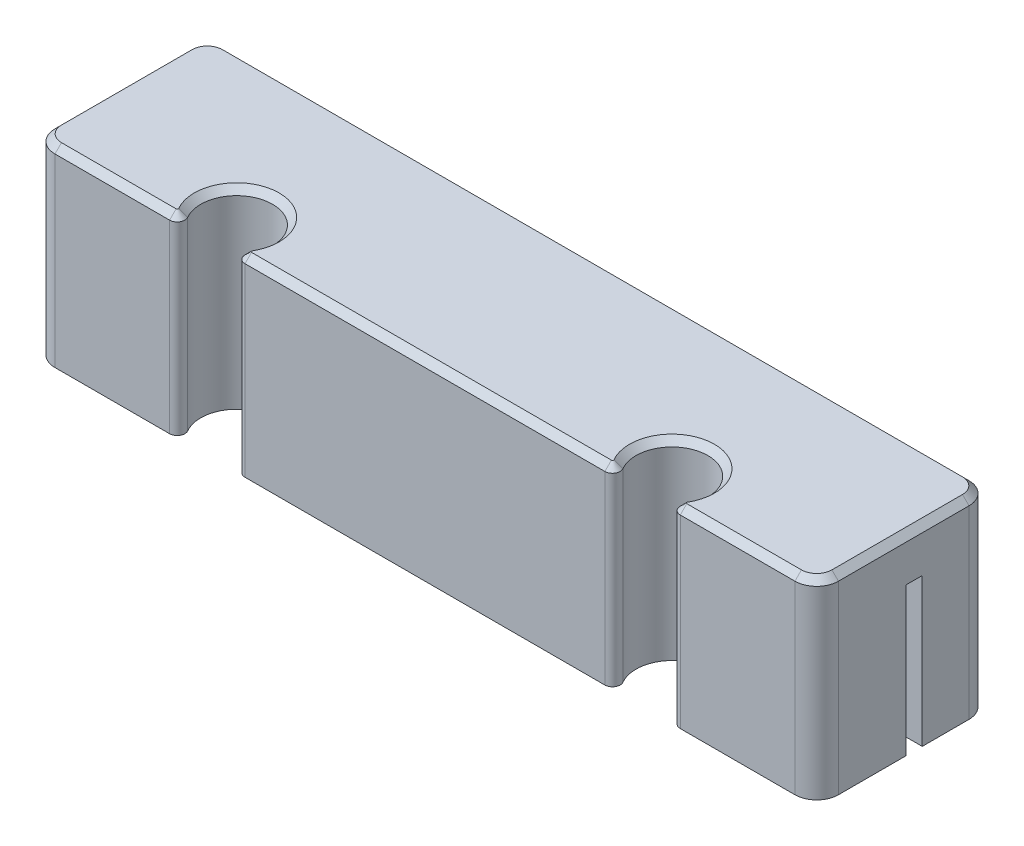
from build123d import *

# Parameters (mm, degrees)
BOSS_EXTRUDE1_DEPTH     = 6.8
SKETCH4_W               = 36
SKETCH4_H               = 8
BOSS_EXTRUDE2_DEPTH     = 2
SKETCH5_W               = 36
SKETCH5_H               = 4.1
BOSS_EXTRUDE3_DEPTH     = 6.8
CUT_EXTRUDE1_DEPTH      = 22.574058496
CUT_EXTRUDE1_DEPTH_BACK = 22.574058496
SKETCH6_R               = 1.65
FILLET3_R               = 0.35
FILLET4_R               = 1
CHAMFER1_SIZE           = 0.3


with BuildPart() as part:
    # Sketch1 → Boss-Extrude1 (new body)
    with BuildSketch(Plane(origin=(0, 0, 0), x_dir=(1, 0, 0), z_dir=(0, 1, 0))):
        Polygon((0, 0), (-18, 0), (-18, -2), (-16.8, -2), (-16.8, -3.15), (-16, -3.15), (-16, -2), (-14.8, -2), (-14.8, -3.15), (-14, -3.15), (-14, -2), (-12.8, -2), (-12.8, -3.15), (-12, -3.15), (-12, -2), (-10.8, -2), (-10.8, -3.15), (-10, -3.15), (-10, -2), (-8.8, -2), (-8.8, -3.15), (-8, -3.15), (-8, -2), (-6.8, -2), (-6.8, -3.15), (-6, -3.15), (-6, -2), (-4.8, -2), (-4.8, -3.15), (-4, -3.15), (-4, -2), (-2.8, -2), (-2.8, -3.15), (-2, -3.15), (-2, -2), (-0.8, -2), (-0.8, -3.15), (0, -3.15), (0, -2), (1.2, -2), (1.2, -3.15), (2, -3.15), (2, -2), (3.2, -2), (3.2, -3.15), (4, -3.15), (4, -2), (5.2, -2), (5.2, -3.15), (6, -3.15), (6, -2), (7.2, -2), (7.2, -3.15), (8, -3.15), (8, -2), (9.2, -2), (9.2, -3.15), (10, -3.15), (10, -2), (11.2, -2), (11.2, -3.15), (12, -3.15), (12, -2), (13.2, -2), (13.2, -3.15), (14, -3.15), (14, -2), (15.2, -2), (15.2, -3.15), (16, -3.15), (16, -2), (17.2, -2), (17.2, -3.15), (18, -3.15), (18, -2), (18, 0), align=None)
    extrude(amount=BOSS_EXTRUDE1_DEPTH)

    # Sketch4 → Boss-Extrude2 (add)
    with BuildSketch(Plane(origin=(0, 6.8, 0), x_dir=(1, 0, 0), z_dir=(0, 1, 0))):
        with Locations((0, -4)):
            Rectangle(SKETCH4_W, SKETCH4_H)
    extrude(amount=BOSS_EXTRUDE2_DEPTH)

    # Sketch5 → Boss-Extrude3 (add)
    with BuildSketch(Plane.XZ.offset(-6.8)):
        with Locations((0, 5.95)):
            Rectangle(SKETCH5_W, SKETCH5_H)
    extrude(amount=BOSS_EXTRUDE3_DEPTH)

    # Sketch6 → Cut-Extrude1 (cut, two sides: drawn at the far end of the back side and taken through both)
    with BuildSketch(Plane(origin=(0, 8.8, 0), x_dir=(1, 0, 0), z_dir=(0, 1, 0)).offset(-CUT_EXTRUDE1_DEPTH_BACK)):
        with Locations((-10, -6.65)):
            Circle(SKETCH6_R)
        with Locations((10, -6.65)):
            Circle(SKETCH6_R)
    extrude(amount=CUT_EXTRUDE1_DEPTH + CUT_EXTRUDE1_DEPTH_BACK, mode=Mode.SUBTRACT)

    # Fillet3
    fillet3_edges = [part.edges().sort_by_distance(p)[0] for p in [
        (9.051316702, 4.4, 8),
        (10.948683298, 4.4, 8),
        (-10.948683298, 4.4, 8),
        (-9.051316702, 4.4, 8),
    ]]
    fillet(fillet3_edges, radius=FILLET3_R)

    # Fillet4
    fillet4_edges = [part.edges().sort_by_distance(p)[0] for p in [
        (18, 4.4, 0),
        (-18, 4.4, 0),
        (-18, 4.4, 8),
        (18, 4.4, 8),
    ]]
    fillet(fillet4_edges, radius=FILLET4_R)

    # Chamfer1
    chamfer1_edges = [part.edges().sort_by_distance(p)[0] for p in [
        (14.366025404, 8.8, 8),
        (10, 8.8, 5),
        (-10, 8.8, 5),
        (0, 8.8, 8),
        (-11.428941916, 8.8, 7.825),
        (-8.571058084, 8.8, 7.825),
        (8.571058084, 8.8, 7.825),
        (11.428941916, 8.8, 7.825),
        (-14.366025404, 8.8, 8),
        (-18, 8.8, 4),
        (18, 8.8, 4),
        (0, 8.8, 0),
        (-17.707106781, 8.8, 0.292893219),
        (17.707106781, 8.8, 0.292893219),
        (17.707106781, 8.8, 7.707106781),
        (-17.707106781, 8.8, 7.707106781),
    ]]
    chamfer(chamfer1_edges, length=CHAMFER1_SIZE)


solid = part.part
